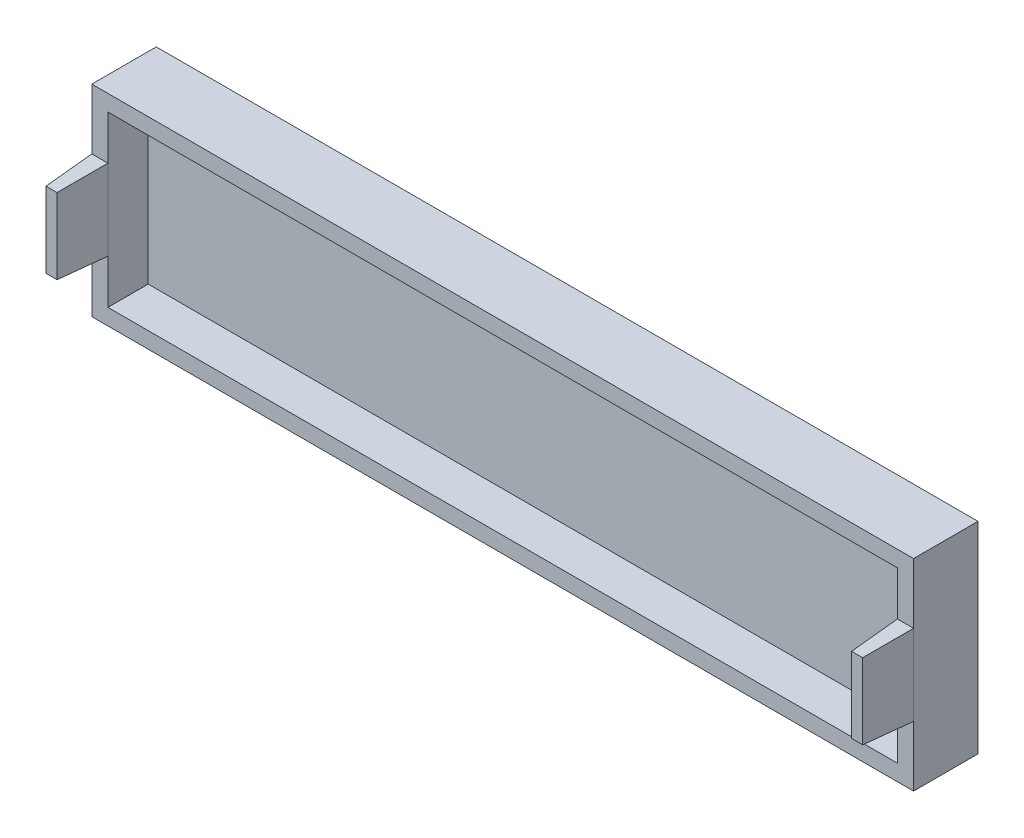
from build123d import *

# Parameters (mm, degrees)
SCHIZZO1_W                   = 102
SCHIZZO1_H                   = 25
ESTRUSIONE_ESTRUSIONE1_DEPTH = 3
SCHIZZO2_W                   = 102
SCHIZZO2_H                   = 25
SCHIZZO2_W_2                 = 98
SCHIZZO2_H_2                 = 21
ESTRUSIONE_ESTRUSIONE2_DEPTH = 5
SCHIZZO3_W                   = 2
SCHIZZO3_H                   = 10
ESTRUSIONE_ESTRUSIONE3_DEPTH = 6
ESTRUSIONE_ESTRUSIONE3_TAPER = 3


with BuildPart() as part:
    # Schizzo1 → Estrusione-Estrusione1 (new body)
    with BuildSketch(Plane.XY):
        Rectangle(SCHIZZO1_W, SCHIZZO1_H)
    extrude(amount=ESTRUSIONE_ESTRUSIONE1_DEPTH)

    # Schizzo2 → Estrusione-Estrusione2 (add)
    with BuildSketch(Plane.XY.offset(3)):
        Rectangle(SCHIZZO2_W, SCHIZZO2_H)
        Rectangle(SCHIZZO2_W_2, SCHIZZO2_H_2, mode=Mode.SUBTRACT)
    extrude(amount=ESTRUSIONE_ESTRUSIONE2_DEPTH)

    # Schizzo3 → Estrusione-Estrusione3 (add)
    with BuildSketch(Plane.XY.offset(8)):
        with Locations((-50, 0)):
            Rectangle(SCHIZZO3_W, SCHIZZO3_H)
    estrusione_estrusione3 = extrude(amount=ESTRUSIONE_ESTRUSIONE3_DEPTH, taper=ESTRUSIONE_ESTRUSIONE3_TAPER)

    # Specchia1: Estrusione-Estrusione3 across plane
    add(estrusione_estrusione3.mirror(Plane(origin=(0, 0, 0), x_dir=(0, 0, 1), z_dir=(1, 0, 0))))


solid = part.part
